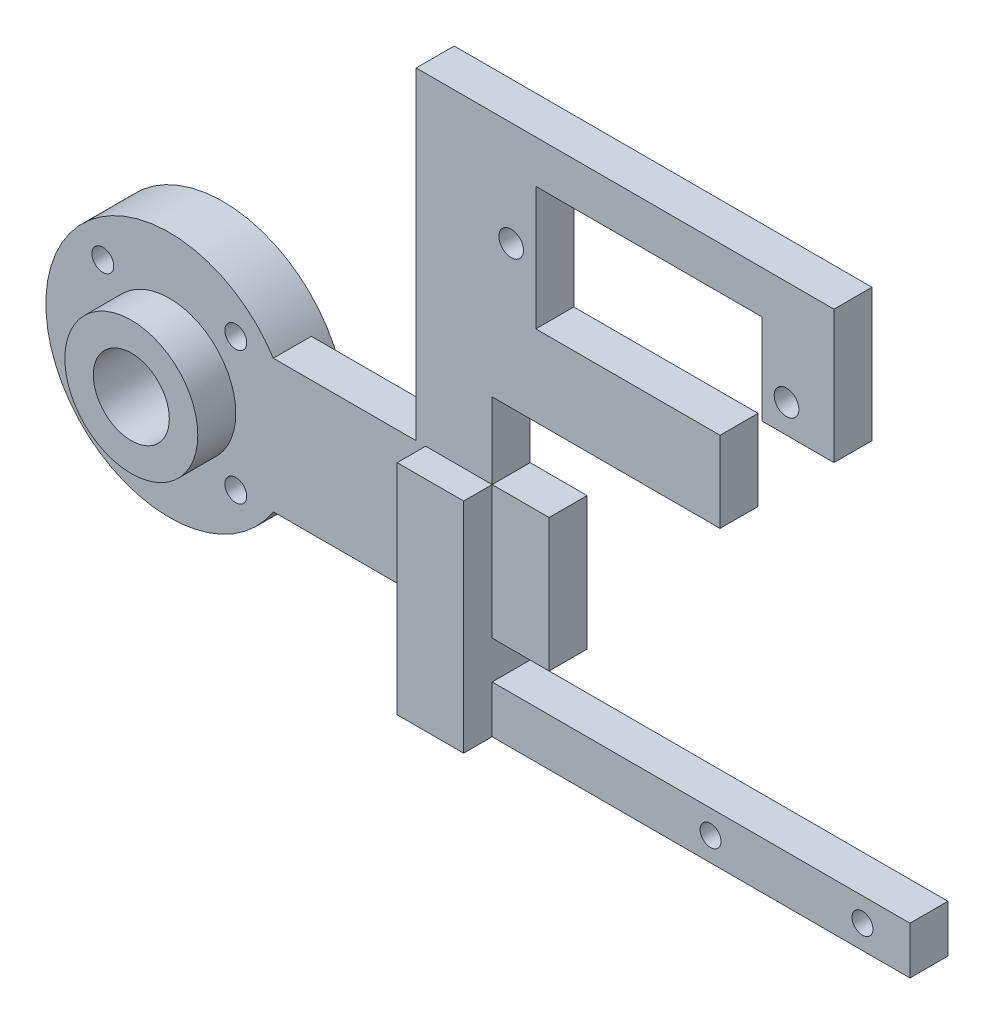
from build123d import *

# Parameters (mm, degrees)
ELBOW_HORN_FLANGE_PROFILE_R          = 13
ELBOW_HORN_FLANGE_DEPTH              = 4
FOREARM_WEB_PROFILE_W                = 40
FOREARM_WEB_PROFILE_H                = 14
FOREARM_WEB_DEPTH                    = 4
GRIPPER_MOUNT_RIB_PROFILE_W          = 8
GRIPPER_MOUNT_RIB_PROFILE_H          = 30
GRIPPER_MOUNT_RIB_DEPTH              = 4
GRIPPER_SERVO_MOUNT_PROFILE_W        = 44
GRIPPER_SERVO_MOUNT_PROFILE_H        = 26
GRIPPER_SERVO_MOUNT_DEPTH            = 4
GRIP_SG90_BODY_CLEARANCE_START       = -5
GRIP_SG90_BODY_CLEARANCE_PROFILE_W   = 23.8
GRIP_SG90_BODY_CLEARANCE_PROFILE_H   = 13
GRIP_SG90_BODY_CLEARANCE_DEPTH       = 87.221918224
MOVING_FINGER_SWEEP_RELIEF_START     = -5
MOVING_FINGER_SWEEP_RELIEF_PROFILE_W = 13
MOVING_FINGER_SWEEP_RELIEF_PROFILE_H = 13
MOVING_FINGER_SWEEP_RELIEF_DEPTH     = 87.221918224
GRIP_SERVO_TAB_FASTENERS_START       = -50
GRIP_SERVO_TAB_FASTENERS_PROFILE_R   = 1.3
GRIP_SERVO_TAB_FASTENERS_DEPTH       = 132.221918224
FIXED_FINGER_SPINE_PROFILE_W         = 48
FIXED_FINGER_SPINE_PROFILE_H         = 5
FIXED_FINGER_SPINE_DEPTH             = 4
FIXED_FINGER_ROOT_PROFILE_W          = 7
FIXED_FINGER_ROOT_PROFILE_H          = 23
FIXED_FINGER_ROOT_DEPTH              = 7
ELBOW_CENTER_SCREW_ACCESS_START      = -50
ELBOW_CENTER_SCREW_ACCESS_PROFILE_R  = 4
ELBOW_CENTER_SCREW_ACCESS_DEPTH      = 139.396832522
ELBOW_DOWEL_SUPPORT_HUB_START        = 4
ELBOW_DOWEL_SUPPORT_HUB_PROFILE_R    = 7
ELBOW_DOWEL_SUPPORT_HUB_PROFILE_R_2  = 4
ELBOW_DOWEL_SUPPORT_HUB_DEPTH        = 4
CAPTURED_HORN_KEY_BOSS_START         = -1.65
CAPTURED_HORN_KEY_BOSS_PROFILE_R     = 13
CAPTURED_HORN_KEY_BOSS_DEPTH         = 1.65
KEY_POCKET_HUB_START                 = -1.65
STOCK_HORN_POCKET_HUB_R              = 3.55
KEY_POCKET_HUB_DEPTH                 = 1.65
KEY_POCKET_HORIZONTAL_START          = -1.65
STOCK_HORN_POCKET_HORIZONTAL_W       = 16.3
STOCK_HORN_POCKET_HORIZONTAL_H       = 4.2
KEY_POCKET_HORIZONTAL_DEPTH          = 1.65
KEY_POCKET_VERTICAL_START            = -1.65
STOCK_HORN_POCKET_VERTICAL_W         = 4.2
STOCK_HORN_POCKET_VERTICAL_H         = 16.3
KEY_POCKET_VERTICAL_DEPTH            = 1.65
KEY_POCKET_ROUNDED_TIPS_START        = -1.65
STOCK_HORN_POCKET_ROUNDED_TIPS_R     = 2.1
KEY_POCKET_ROUNDED_TIPS_DEPTH        = 1.65
UNMODIFIED_HORN_CAPTURE_M2_START     = -50
UNMODIFIED_HORN_CAPTURE_M2_PROFILE_R = 1.15
UNMODIFIED_HORN_CAPTURE_M2_DEPTH     = 139.481636513
HUB_CLEARANCE_IN_KEY_BOSS_ONLY_START = -1.65
HORN_CENTER_HUB_CLEARANCE_R          = 4
HUB_CLEARANCE_IN_KEY_BOSS_ONLY_DEPTH = 1.65
FIXED_PAD_KEEPER_FASTENERS_START     = -50
FIXED_PAD_KEEPER_FASTENERS_PROFILE_R = 1.1
FIXED_PAD_KEEPER_FASTENERS_DEPTH     = 139.481636513


with BuildPart() as part:
    # Elbow_horn_flange_profile → Elbow_horn_flange (new body)
    with BuildSketch(Plane.XY):
        Circle(ELBOW_HORN_FLANGE_PROFILE_R)
    extrude(amount=ELBOW_HORN_FLANGE_DEPTH)

    # Forearm_web_profile → Forearm_web (add)
    with BuildSketch(Plane.XY):
        with Locations((20, 0)):
            Rectangle(FOREARM_WEB_PROFILE_W, FOREARM_WEB_PROFILE_H)
    extrude(amount=FOREARM_WEB_DEPTH)

    # Gripper_mount_rib_profile → Gripper_mount_rib (add)
    with BuildSketch(Plane.XY):
        with Locations((30, 15)):
            Rectangle(GRIPPER_MOUNT_RIB_PROFILE_W, GRIPPER_MOUNT_RIB_PROFILE_H)
    extrude(amount=GRIPPER_MOUNT_RIB_DEPTH)

    # Gripper_servo_mount_profile → Gripper_servo_mount (add)
    with BuildSketch(Plane.XY):
        with Locations((48, 28)):
            Rectangle(GRIPPER_SERVO_MOUNT_PROFILE_W, GRIPPER_SERVO_MOUNT_PROFILE_H)
    extrude(amount=GRIPPER_SERVO_MOUNT_DEPTH)

    # Grip_SG90_body_clearance_profile → Grip_SG90_body_clearance (cut, through all)
    with BuildSketch(Plane.XY.offset(GRIP_SG90_BODY_CLEARANCE_START)):
        with Locations((50.5, 30)):
            Rectangle(GRIP_SG90_BODY_CLEARANCE_PROFILE_W, GRIP_SG90_BODY_CLEARANCE_PROFILE_H)
    extrude(amount=GRIP_SG90_BODY_CLEARANCE_DEPTH, mode=Mode.SUBTRACT)

    # Moving_finger_sweep_relief_profile → Moving_finger_sweep_relief (cut, through all)
    with BuildSketch(Plane.XY.offset(MOVING_FINGER_SWEEP_RELIEF_START)):
        with Locations((64.5, 20.5)):
            Rectangle(MOVING_FINGER_SWEEP_RELIEF_PROFILE_W, MOVING_FINGER_SWEEP_RELIEF_PROFILE_H)
    extrude(amount=MOVING_FINGER_SWEEP_RELIEF_DEPTH, mode=Mode.SUBTRACT)

    # Grip_servo_tab_fasteners_profile → Grip_servo_tab_fasteners (cut, through all)
    with BuildSketch(Plane.XY.offset(GRIP_SERVO_TAB_FASTENERS_START)):
        with Locations((36, 30)):
            Circle(GRIP_SERVO_TAB_FASTENERS_PROFILE_R)
        with Locations((65, 30)):
            Circle(GRIP_SERVO_TAB_FASTENERS_PROFILE_R)
    extrude(amount=GRIP_SERVO_TAB_FASTENERS_DEPTH, mode=Mode.SUBTRACT)



with BuildPart() as body_2:
    # Fixed_finger_spine_profile → Fixed_finger_spine (new body)
    with BuildSketch(Plane.XY):
        with Locations((54, -13.5)):
            Rectangle(FIXED_FINGER_SPINE_PROFILE_W, FIXED_FINGER_SPINE_PROFILE_H)
    extrude(amount=FIXED_FINGER_SPINE_DEPTH)


with BuildPart() as part_1:
    add(part.part)

    add(body_2.part)  # Fixed_finger_root merges body 2
    # Fixed_finger_root_profile → Fixed_finger_root (add)
    with BuildSketch(Plane.XY):
        with Locations((30.5, -4.5)):
            Rectangle(FIXED_FINGER_ROOT_PROFILE_W, FIXED_FINGER_ROOT_PROFILE_H)
    extrude(amount=FIXED_FINGER_ROOT_DEPTH)

    # Elbow_center_screw_access_profile → Elbow_center_screw_access (cut, through all)
    with BuildSketch(Plane.XY.offset(ELBOW_CENTER_SCREW_ACCESS_START)):
        with Locations(Location((0, 0, 0), (0, 0, 180))):
            Circle(ELBOW_CENTER_SCREW_ACCESS_PROFILE_R)
    extrude(amount=ELBOW_CENTER_SCREW_ACCESS_DEPTH, mode=Mode.SUBTRACT)

    # Elbow_dowel_support_hub_profile → Elbow_dowel_support_hub (add)
    with BuildSketch(Plane.XY.offset(ELBOW_DOWEL_SUPPORT_HUB_START)):
        Circle(ELBOW_DOWEL_SUPPORT_HUB_PROFILE_R)
        with Locations(Location((0, 0, 0), (0, 0, 180))):
            Circle(ELBOW_DOWEL_SUPPORT_HUB_PROFILE_R_2, mode=Mode.SUBTRACT)
    extrude(amount=ELBOW_DOWEL_SUPPORT_HUB_DEPTH)

    # Captured_horn_key_boss_profile → Captured_horn_key_boss (add)
    with BuildSketch(Plane.XY.offset(CAPTURED_HORN_KEY_BOSS_START)):
        with Locations(Location((0, 0, 0), (0, 0, 32.578970393))):
            Circle(CAPTURED_HORN_KEY_BOSS_PROFILE_R)
    extrude(amount=CAPTURED_HORN_KEY_BOSS_DEPTH)

    # Stock_horn_pocket_Hub → Key_pocket_Hub (cut)
    with BuildSketch(Plane.XY.offset(KEY_POCKET_HUB_START)):
        Circle(STOCK_HORN_POCKET_HUB_R)
    extrude(amount=KEY_POCKET_HUB_DEPTH, mode=Mode.SUBTRACT)

    # Stock_horn_pocket_Horizontal → Key_pocket_Horizontal (cut)
    with BuildSketch(Plane.XY.offset(KEY_POCKET_HORIZONTAL_START)):
        Rectangle(STOCK_HORN_POCKET_HORIZONTAL_W, STOCK_HORN_POCKET_HORIZONTAL_H)
    extrude(amount=KEY_POCKET_HORIZONTAL_DEPTH, mode=Mode.SUBTRACT)

    # Stock_horn_pocket_Vertical → Key_pocket_Vertical (cut)
    with BuildSketch(Plane.XY.offset(KEY_POCKET_VERTICAL_START)):
        Rectangle(STOCK_HORN_POCKET_VERTICAL_W, STOCK_HORN_POCKET_VERTICAL_H)
    extrude(amount=KEY_POCKET_VERTICAL_DEPTH, mode=Mode.SUBTRACT)

    # Stock_horn_pocket_Rounded_tips → Key_pocket_Rounded_tips (cut)
    with BuildSketch(Plane.XY.offset(KEY_POCKET_ROUNDED_TIPS_START)):
        with Locations((8.15, 0)):
            Circle(STOCK_HORN_POCKET_ROUNDED_TIPS_R)
        with Locations((-8.15, 0)):
            Circle(STOCK_HORN_POCKET_ROUNDED_TIPS_R)
        with Locations((0, 8.15)):
            Circle(STOCK_HORN_POCKET_ROUNDED_TIPS_R)
        with Locations((0, -8.15)):
            Circle(STOCK_HORN_POCKET_ROUNDED_TIPS_R)
    extrude(amount=KEY_POCKET_ROUNDED_TIPS_DEPTH, mode=Mode.SUBTRACT)

    # Unmodified_horn_capture_M2_profile → Unmodified_horn_capture_M2 (cut, through all)
    with BuildSketch(Plane.XY.offset(UNMODIFIED_HORN_CAPTURE_M2_START)):
        with Locations(Location((7, 7, 0), (0, 0, 180))):
            Circle(UNMODIFIED_HORN_CAPTURE_M2_PROFILE_R)
        with Locations(Location((-7, 7, 0), (0, 0, 180))):
            Circle(UNMODIFIED_HORN_CAPTURE_M2_PROFILE_R)
        with Locations(Location((-7, -7, 0), (0, 0, 180))):
            Circle(UNMODIFIED_HORN_CAPTURE_M2_PROFILE_R)
        with Locations(Location((7, -7, 0), (0, 0, 180))):
            Circle(UNMODIFIED_HORN_CAPTURE_M2_PROFILE_R)
    extrude(amount=UNMODIFIED_HORN_CAPTURE_M2_DEPTH, mode=Mode.SUBTRACT)

    # Horn_center_hub_clearance → Hub_clearance_in_key_boss_only (cut)
    with BuildSketch(Plane.XY.offset(HUB_CLEARANCE_IN_KEY_BOSS_ONLY_START)):
        with Locations(Location((0, 0, 0), (0, 0, 148.331756746))):
            Circle(HORN_CENTER_HUB_CLEARANCE_R)
    extrude(amount=HUB_CLEARANCE_IN_KEY_BOSS_ONLY_DEPTH, mode=Mode.SUBTRACT)

    # Fixed_pad_keeper_fasteners_profile → Fixed_pad_keeper_fasteners (cut, through all)
    with BuildSketch(Plane.XY.offset(FIXED_PAD_KEEPER_FASTENERS_START)):
        with Locations(Location((57, -13.5, 0), (0, 0, 180))):
            Circle(FIXED_PAD_KEEPER_FASTENERS_PROFILE_R)
        with Locations(Location((73, -13.5, 0), (0, 0, 180))):
            Circle(FIXED_PAD_KEEPER_FASTENERS_PROFILE_R)
    extrude(amount=FIXED_PAD_KEEPER_FASTENERS_DEPTH, mode=Mode.SUBTRACT)


solid = part_1.part
